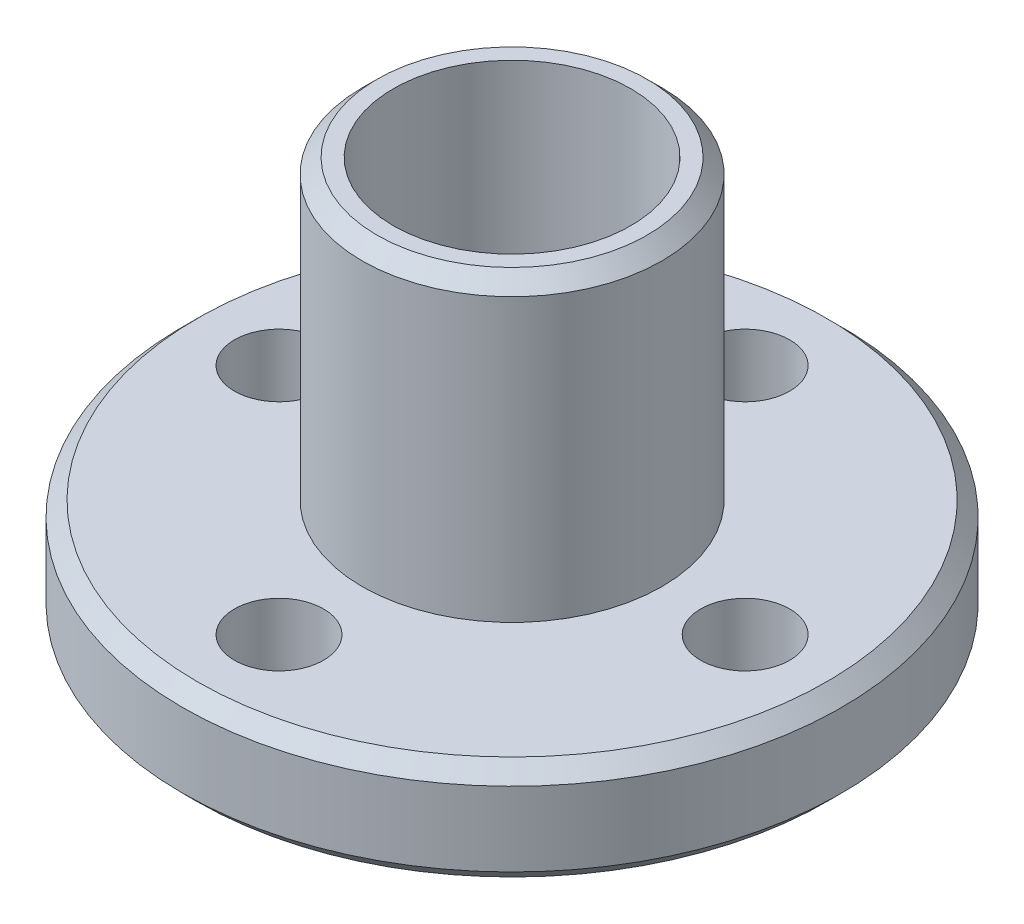
from build123d import *

# Parameters (mm, degrees)
SKETCH1_R           = 11.1
SKETCH1_R_2         = 4
BOSS_EXTRUDE1_DEPTH = 3.5
SKETCH2_R           = 5.05
SKETCH2_R_2         = 4
BOSS_EXTRUDE2_DEPTH = 10
BOSS_EXTRUDE3_START = 1.5
SKETCH3_R           = 5.05
SKETCH3_R_2         = 4
BOSS_EXTRUDE3_DEPTH = 1.5
CUT_EXTRUDE1_REACH  = 22.704
SKETCH4_R           = 1.5
CHAMFER1_SIZE       = 0.5
CHAMFER2_SIZE       = 0.5


with BuildPart() as part:
    # Sketch1 → Boss-Extrude1 (new body)
    with BuildSketch(Plane(origin=(0, 0, 0), x_dir=(1, 0, 0), z_dir=(0, 1, 0))):
        with Locations(Location((0, 0, 0), (0, 0, 270))):
            Circle(SKETCH1_R)
        with Locations(Location((0, 0, 0), (0, 0, 270))):
            Circle(SKETCH1_R_2, mode=Mode.SUBTRACT)
    extrude(amount=BOSS_EXTRUDE1_DEPTH)

    # Sketch2 → Boss-Extrude2 (add)
    with BuildSketch(Plane(origin=(0, 3.5, 0), x_dir=(1, 0, 0), z_dir=(0, 1, 0))):
        with Locations(Location((0, 0, 0), (0, 0, 270))):
            Circle(SKETCH2_R)
        with Locations(Location((0, 0, 0), (0, 0, 270))):
            Circle(SKETCH2_R_2, mode=Mode.SUBTRACT)
    extrude(amount=BOSS_EXTRUDE2_DEPTH)

    # Sketch3 → Boss-Extrude3 (add)
    with BuildSketch(Plane.XZ.offset(BOSS_EXTRUDE3_START)):
        with Locations(Location((0, 0, 0), (0, 0, 90))):
            Circle(SKETCH3_R)
        with Locations(Location((0, 0, 0), (0, 0, 270))):
            Circle(SKETCH3_R_2, mode=Mode.SUBTRACT)
    extrude(amount=-BOSS_EXTRUDE3_DEPTH)

    # Sketch4 → Cut-Extrude1 (cut, up to next)
    with BuildSketch(Plane.XZ, mode=Mode.PRIVATE) as cut_extrude1_sk1:
        with Locations(Location((-7.85, 0, 0), (0, 0, 270))):
            Circle(SKETCH4_R)
    cut_extrude1_tool1 = extrude(cut_extrude1_sk1.sketch, amount=-CUT_EXTRUDE1_REACH, mode=Mode.PRIVATE) & part.part
    # Sketch4 → Cut-Extrude1 (cut, up to next)
    with BuildSketch(Plane.XZ, mode=Mode.PRIVATE) as cut_extrude1_sk2:
        with Locations(Location((0, 7.85, 0), (0, 0, 270))):
            Circle(SKETCH4_R)
    cut_extrude1_tool2 = extrude(cut_extrude1_sk2.sketch, amount=-CUT_EXTRUDE1_REACH, mode=Mode.PRIVATE) & part.part
    # Sketch4 → Cut-Extrude1 (cut, up to next)
    with BuildSketch(Plane.XZ, mode=Mode.PRIVATE) as cut_extrude1_sk3:
        with Locations(Location((7.85, 0, 0), (0, 0, 270))):
            Circle(SKETCH4_R)
    cut_extrude1_tool3 = extrude(cut_extrude1_sk3.sketch, amount=-CUT_EXTRUDE1_REACH, mode=Mode.PRIVATE) & part.part
    # Sketch4 → Cut-Extrude1 (cut, up to next)
    with BuildSketch(Plane.XZ, mode=Mode.PRIVATE) as cut_extrude1_sk4:
        with Locations(Location((0, -7.85, 0), (0, 0, 270))):
            Circle(SKETCH4_R)
    cut_extrude1_tool4 = extrude(cut_extrude1_sk4.sketch, amount=-CUT_EXTRUDE1_REACH, mode=Mode.PRIVATE) & part.part
    add(cut_extrude1_tool1.solids().sort_by_distance((-7.85, 0, 0))[0], mode=Mode.SUBTRACT)
    add(cut_extrude1_tool2.solids().sort_by_distance((0, 0, 7.85))[0], mode=Mode.SUBTRACT)
    add(cut_extrude1_tool3.solids().sort_by_distance((7.85, 0, 0))[0], mode=Mode.SUBTRACT)
    add(cut_extrude1_tool4.solids().sort_by_distance((0, 0, -7.85))[0], mode=Mode.SUBTRACT)

    # Chamfer1
    chamfer1_edges = [part.edges().sort_by_distance(p)[0] for p in [
        (0, 13.5, -5.05),
        (0, -1.5, -5.05),
        (0, 0, -11.1),
        (0, 3.5, -11.1),
    ]]
    chamfer(chamfer1_edges, length=CHAMFER1_SIZE)

    # Chamfer2
    chamfer2_edges = [part.edges().sort_by_distance(p)[0] for p in [
        (0, 0, -5.05),
    ]]
    chamfer(chamfer2_edges, length=CHAMFER2_SIZE)


solid = part.part
